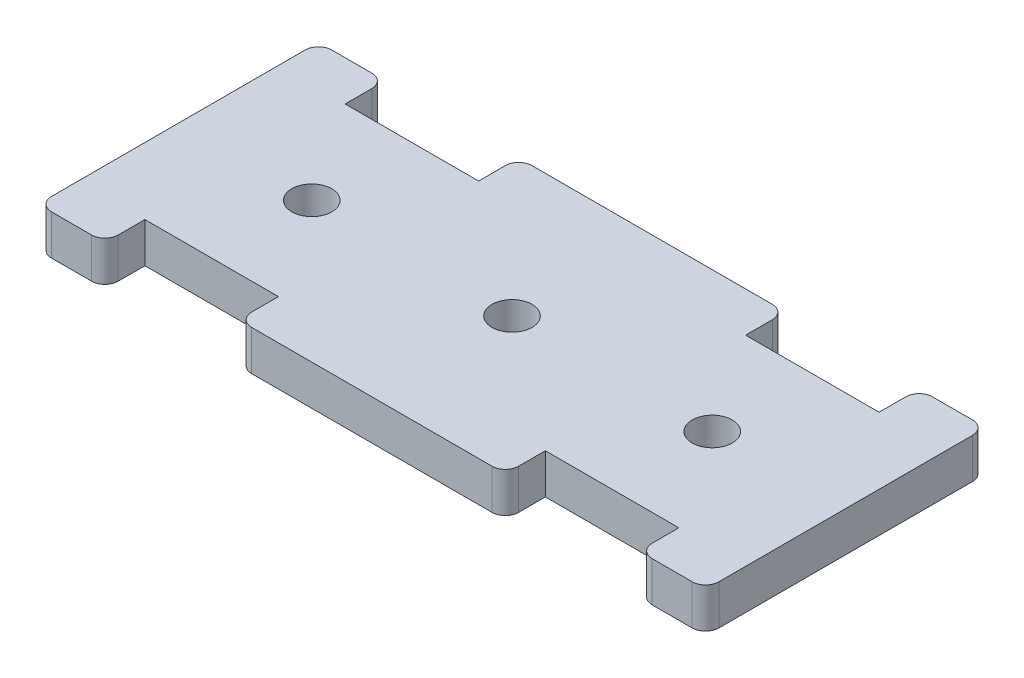
from build123d import *

# Parameters (mm, degrees)
SKETCH_1_R      = 1.5
EXTRUDE_1_DEPTH = 3
FILLET_1_R      = 1


with BuildPart() as part:
    # 草图1 → 凸台-拉伸1 (new body)
    with BuildSketch(Plane(origin=(0, 0, 0), x_dir=(1, 0, 0), z_dir=(0, 1, 0))):
        Polygon((0, 10.5), (0, -10.5), (5, -10.5), (5, -7.5), (15, -7.5), (15, -10.5), (35, -10.5), (35, -7.5), (45, -7.5), (45, -10.5), (50, -10.5), (50, 10.5), (45, 10.5), (45, 7.5), (35, 7.5), (35, 10.5), (15, 10.5), (15, 7.5), (5, 7.5), (5, 10.5), align=None)
        with Locations(Location((10, 0, 0), (0, 0, 270))):
            Circle(SKETCH_1_R, mode=Mode.SUBTRACT)
        with Locations(Location((40, 0, 0), (0, 0, 270))):
            Circle(SKETCH_1_R, mode=Mode.SUBTRACT)
        with Locations(Location((25, 0, 0), (0, 0, 270))):
            Circle(SKETCH_1_R, mode=Mode.SUBTRACT)
    extrude(amount=EXTRUDE_1_DEPTH)

    # 圆角1
    fillet_1_edges = [part.edges().sort_by_distance(p)[0] for p in [
        (0, 1.5, 10.5),
        (0, 1.5, -10.5),
        (5, 1.5, -10.5),
        (15, 1.5, -10.5),
        (35, 1.5, -10.5),
        (45, 1.5, -10.5),
        (50, 1.5, -10.5),
        (50, 1.5, 10.5),
        (45, 1.5, 10.5),
        (35, 1.5, 10.5),
        (15, 1.5, 10.5),
        (5, 1.5, 10.5),
    ]]
    fillet(fillet_1_edges, radius=FILLET_1_R)


solid = part.part
